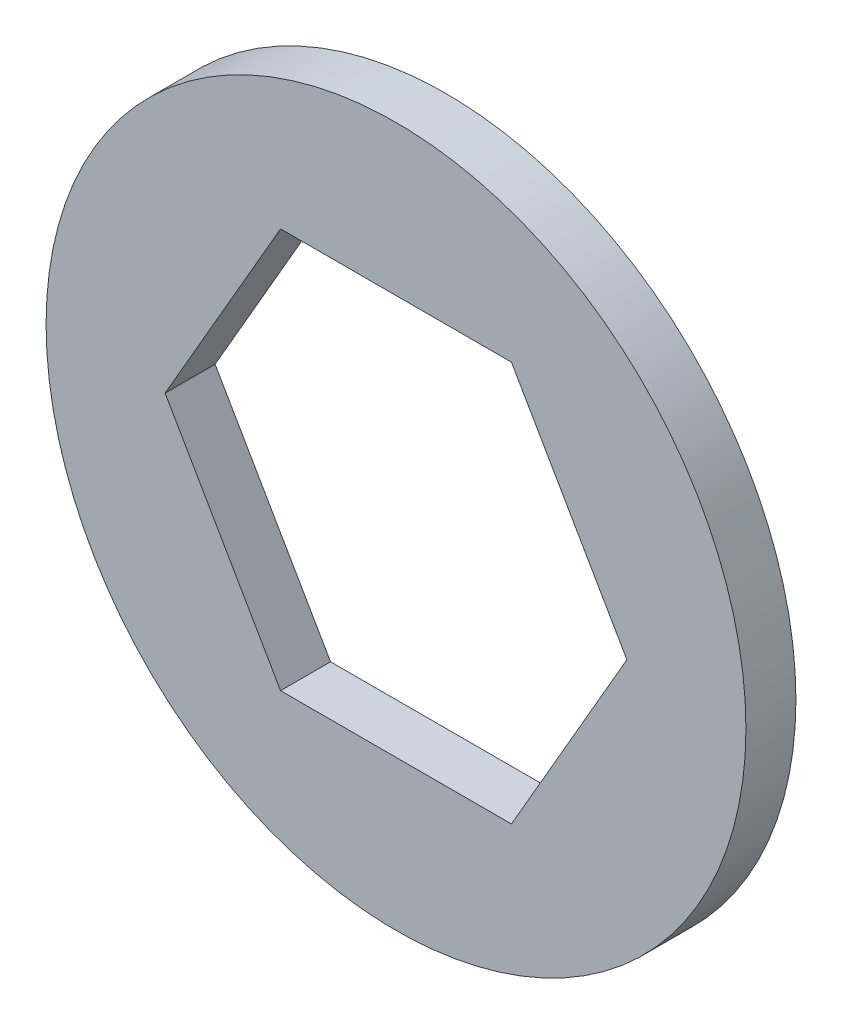
from build123d import *

# Parameters (mm, degrees)
SKETCH1_R           = 11.1125
BOSS_EXTRUDE1_DEPTH = 1.5875


with BuildPart() as part:
    # Sketch1 → Boss-Extrude1 (new body)
    with BuildSketch(Plane.XY):
        Circle(SKETCH1_R)
        Polygon((3.666174209, 6.35), (-3.666174209, 6.35), (-7.332348419, 0), (-3.666174209, -6.35), (3.666174209, -6.35), (7.332348419, 0), align=None, mode=Mode.SUBTRACT)
    extrude(amount=BOSS_EXTRUDE1_DEPTH)


solid = part.part
